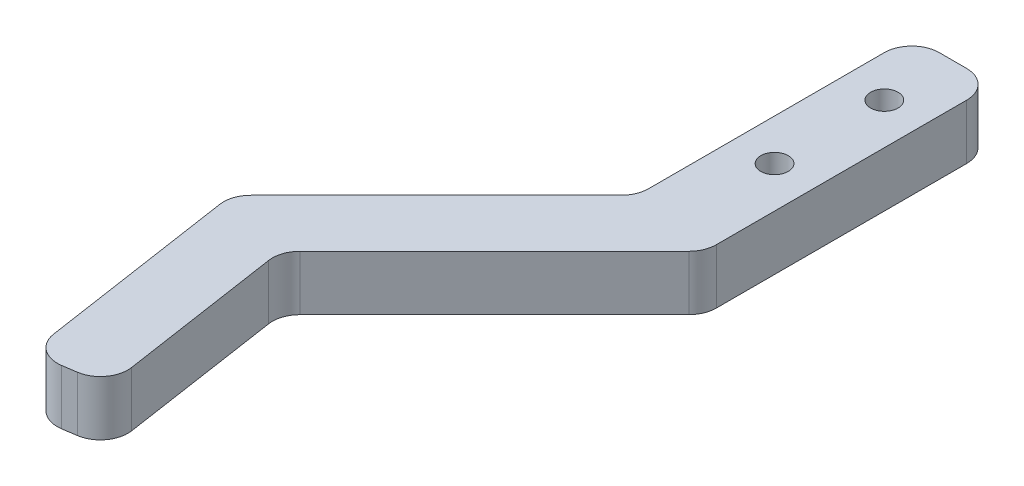
from build123d import *

# Parameters (mm, degrees)
SKETCH_1_R      = 1
EXTRUDE_1_DEPTH = 4
FILLET_1_R      = 2


with BuildPart() as part:
    # 草图1 → 凸台-拉伸1 (new body)
    with BuildSketch(Plane(origin=(0, 0, 0), x_dir=(1, 0, 0), z_dir=(0, 1, 0))):
        Polygon((22.744681764, 13.741702265), (17.8, 13), (15.217391304, 30.217391304), (25, 40), (30, 45), (30, 65), (36, 65), (36, 43.928932188), (30.292893219, 38.221825407), (20.536171544, 28.465103732), align=None)
        with Locations(Location((33, 52, 0), (0, 0, 270))):
            Circle(SKETCH_1_R, mode=Mode.SUBTRACT)
        with Locations(Location((33, 60, 0), (0, 0, 270))):
            Circle(SKETCH_1_R, mode=Mode.SUBTRACT)
    extrude(amount=EXTRUDE_1_DEPTH)

    # 圆角1
    fillet_1_edges = [part.edges().sort_by_distance(p)[0] for p in [
        (17.8, 2, -13),
        (15.217391304, 2, -30.217391304),
        (30, 2, -45),
        (30, 2, -65),
        (36, 2, -65),
        (36, 2, -43.928932188),
        (20.536171544, 2, -28.465103732),
        (22.744681764, 2, -13.741702265),
    ]]
    fillet(fillet_1_edges, radius=FILLET_1_R)


solid = part.part
